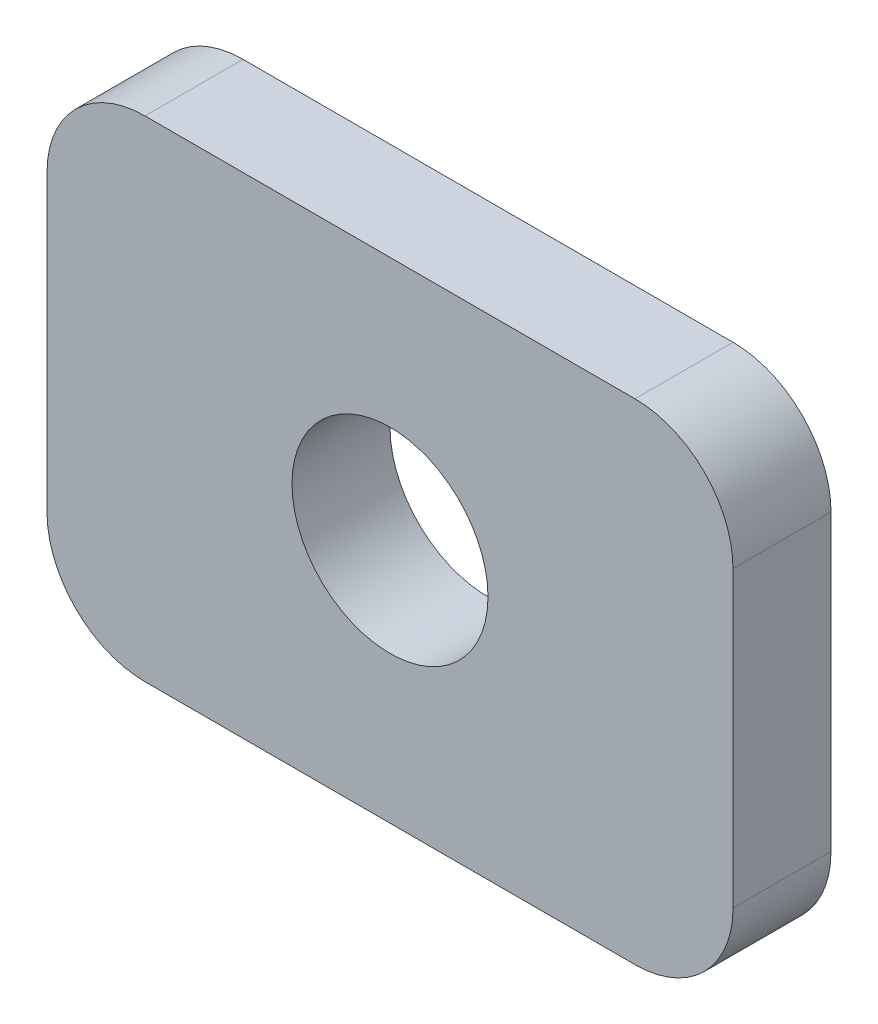
from build123d import *

# Parameters (mm, degrees)
SKETCH_1_R      = 10
EXTRUDE_1_DEPTH = 10


with BuildPart() as part:
    # Эскиз1 → Бобышка-Вытянуть1 (new body)
    with BuildSketch(Plane.XY):
        with BuildLine():
            Line((10, 0), (60, 0))
            ThreePointArc((60, 0), (67.071067812, 2.928932188), (70, 10))
            Line((70, 10), (70, 40))
            ThreePointArc((70, 40), (67.071067812, 47.071067812), (60, 50))
            Line((60, 50), (10, 50))
            ThreePointArc((10, 50), (2.928932188, 47.071067812), (0, 40))
            Line((0, 40), (0, 10))
            ThreePointArc((0, 10), (2.928932188, 2.928932188), (10, 0))
        make_face()
        with Locations((35, 25)):
            Circle(SKETCH_1_R, mode=Mode.SUBTRACT)
    extrude(amount=EXTRUDE_1_DEPTH)


solid = part.part
